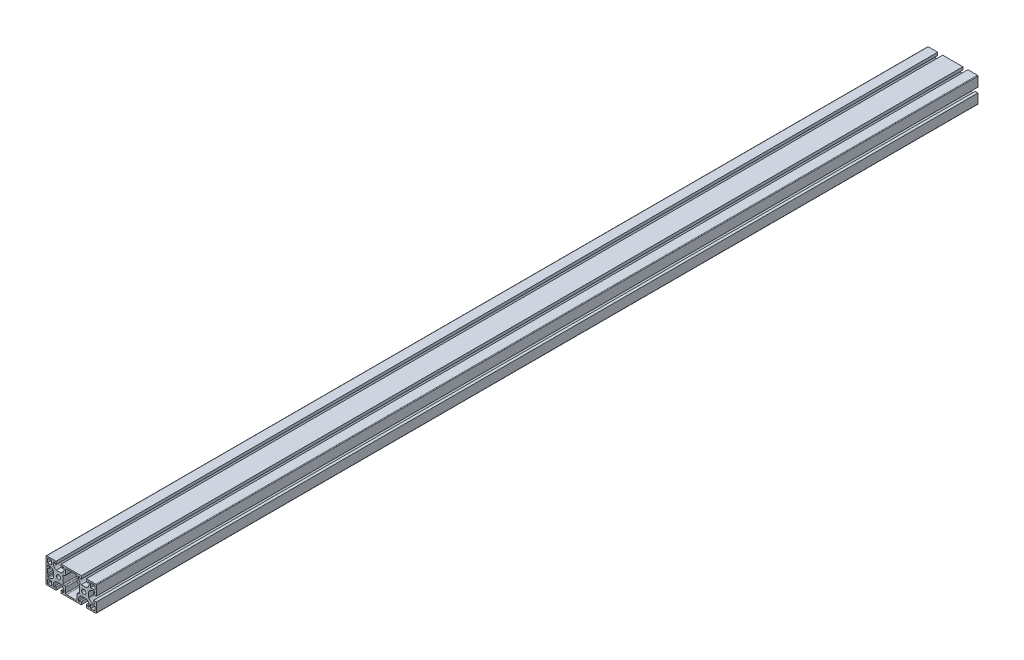
from build123d import *

# Parameters (mm, degrees)
SZKIC1_R                    = 3.4
DODANIE_WYCI_GNI_CIE1_DEPTH = 1400


with BuildPart() as part:
    # Szkic1 → Dodanie-wyciągnięcie1 (new body)
    with BuildSketch(Plane.XY):
        with BuildLine():
            Line((-40, -19), (-40, 19))
            ThreePointArc((-40, 19), (-39.707106781, 19.707106781), (-39, 20))
            Line((-39, 20), (-24, 20))
            Line((-24, 20), (-24, 15.5))
            Line((-24, 15.5), (-26.471381771, 15.5))
            Line((-26.471381771, 15.5), (-26.471381771, 17.75))
            ThreePointArc((-26.471381771, 17.75), (-28.062372029, 17.090990258), (-28.721381771, 15.5))
            ThreePointArc((-28.721381771, 15.5), (-27.448087912, 10.962546258), (-24, 7.75))
            Line((-24, 7.75), (-16, 7.75))
            ThreePointArc((-16, 7.75), (-12.551912088, 10.962546258), (-11.278618229, 15.5))
            ThreePointArc((-11.278618229, 15.5), (-11.937627971, 17.090990258), (-13.528618229, 17.75))
            Line((-13.528618229, 17.75), (-13.528618229, 15.5))
            Line((-13.528618229, 15.5), (-16, 15.5))
            Line((-16, 15.5), (-16, 20))
            Line((-16, 20), (13.528618229, 20))
            Line((13.528618229, 20), (16, 20))
            Line((16, 20), (16, 15.5))
            Line((16, 15.5), (13.528618229, 15.5))
            Line((13.528618229, 15.5), (13.528618229, 17.75))
            ThreePointArc((13.528618229, 17.75), (11.937627971, 17.090990258), (11.278618229, 15.5))
            ThreePointArc((11.278618229, 15.5), (12.551912088, 10.962546258), (16, 7.75))
            Line((16, 7.75), (24, 7.75))
            ThreePointArc((24, 7.75), (27.448087912, 10.962546258), (28.721381771, 15.5))
            ThreePointArc((28.721381771, 15.5), (28.062372029, 17.090990258), (26.471381771, 17.75))
            Line((26.471381771, 17.75), (26.471381771, 15.5))
            Line((26.471381771, 15.5), (24, 15.5))
            Line((24, 15.5), (24, 20))
            Line((24, 20), (39, 20))
            ThreePointArc((39, 20), (39.707106781, 19.707106781), (40, 19))
            Line((40, 19), (40, 4))
            Line((40, 4), (35.5, 4))
            Line((35.5, 4), (35.5, 6.471381771))
            Line((35.5, 6.471381771), (37.75, 6.471381771))
            ThreePointArc((37.75, 6.471381771), (37.090990258, 8.062372029), (35.5, 8.721381771))
            ThreePointArc((35.5, 8.721381771), (30.962546258, 7.448087912), (27.75, 4))
            Line((27.75, 4), (27.75, -4))
            ThreePointArc((27.75, -4), (30.962546258, -7.448087912), (35.5, -8.721381771))
            ThreePointArc((35.5, -8.721381771), (37.090990258, -8.062372029), (37.75, -6.471381771))
            Line((37.75, -6.471381771), (35.5, -6.471381771))
            Line((35.5, -6.471381771), (35.5, -4))
            Line((35.5, -4), (40, -4))
            Line((40, -4), (40, -19))
            ThreePointArc((40, -19), (39.707106781, -19.707106781), (39, -20))
            Line((39, -20), (24, -20))
            Line((24, -20), (24, -15.5))
            Line((24, -15.5), (26.471381771, -15.5))
            Line((26.471381771, -15.5), (26.471381771, -17.75))
            ThreePointArc((26.471381771, -17.75), (28.062372029, -17.090990258), (28.721381771, -15.5))
            ThreePointArc((28.721381771, -15.5), (27.448087912, -10.962546258), (24, -7.75))
            Line((24, -7.75), (16, -7.75))
            ThreePointArc((16, -7.75), (12.551912088, -10.962546258), (11.278618229, -15.5))
            ThreePointArc((11.278618229, -15.5), (11.937627971, -17.090990258), (13.528618229, -17.75))
            Line((13.528618229, -17.75), (13.528618229, -15.5))
            Line((13.528618229, -15.5), (16, -15.5))
            Line((16, -15.5), (16, -20))
            Line((16, -20), (-16, -20))
            Line((-16, -20), (-16, -15.5))
            Line((-16, -15.5), (-13.528618229, -15.5))
            Line((-13.528618229, -15.5), (-13.528618229, -17.75))
            ThreePointArc((-13.528618229, -17.75), (-11.937627971, -17.090990258), (-11.278618229, -15.5))
            ThreePointArc((-11.278618229, -15.5), (-12.551912088, -10.962546258), (-16, -7.75))
            Line((-16, -7.75), (-24, -7.75))
            ThreePointArc((-24, -7.75), (-27.448087912, -10.962546258), (-28.721381771, -15.5))
            ThreePointArc((-28.721381771, -15.5), (-28.062372029, -17.090990258), (-26.471381771, -17.75))
            Line((-26.471381771, -17.75), (-26.471381771, -15.5))
            Line((-26.471381771, -15.5), (-24, -15.5))
            Line((-24, -15.5), (-24, -20))
            Line((-24, -20), (-39, -20))
            ThreePointArc((-39, -20), (-39.707106781, -19.707106781), (-40, -19))
        make_face()
        with Locations((-20, 0)):
            Circle(SZKIC1_R, mode=Mode.SUBTRACT)
        with Locations((20, 0)):
            Circle(SZKIC1_R, mode=Mode.SUBTRACT)
        with BuildLine():
            Line((30.971381771, -17.75), (36.75, -17.75))
            ThreePointArc((36.75, -17.75), (37.457106781, -17.457106781), (37.75, -16.75))
            Line((37.75, -16.75), (37.75, -10.971381771))
            Line((37.75, -10.971381771), (30.971381771, -10.971381771))
            Line((30.971381771, -10.971381771), (30.971381771, -17.75))
        make_face(mode=Mode.SUBTRACT)
        with BuildLine():
            Line((-35.5, -6.471381771), (-37.75, -6.471381771))
            ThreePointArc((-37.75, -6.471381771), (-37.090990258, -8.062372029), (-35.5, -8.721381771))
            ThreePointArc((-35.5, -8.721381771), (-30.962546258, -7.448087912), (-27.75, -4))
            Line((-27.75, -4), (-27.75, 4))
            ThreePointArc((-27.75, 4), (-30.962546258, 7.448087912), (-35.5, 8.721381771))
            ThreePointArc((-35.5, 8.721381771), (-37.090990258, 8.062372029), (-37.75, 6.471381771))
            Line((-37.75, 6.471381771), (-35.5, 6.471381771))
            Line((-35.5, 6.471381771), (-35.5, 4))
            Line((-35.5, 4), (-37.75, 4))
            Line((-37.75, 4), (-37.75, -4))
            Line((-37.75, -4), (-35.5, -4))
            Line((-35.5, -4), (-35.5, -6.471381771))
        make_face(mode=Mode.SUBTRACT)
        with BuildLine():
            Line((10.528618229, 7.090188806), (11.40950808, 7.090188806))
            ThreePointArc((11.40950808, 7.090188806), (12.470168251, 6.650848977), (12.90950808, 5.590188806))
            Line((12.90950808, 5.590188806), (12.90950808, -5.590188806))
            ThreePointArc((12.90950808, -5.590188806), (12.470168251, -6.650848977), (11.40950808, -7.090188806))
            Line((11.40950808, -7.090188806), (10.528618229, -7.090188806))
            ThreePointArc((10.528618229, -7.090188806), (9.467958057, -7.529528634), (9.028618229, -8.590188806))
            Line((9.028618229, -8.590188806), (9.028618229, -16.25))
            ThreePointArc((9.028618229, -16.25), (8.589278401, -17.310660172), (7.528618229, -17.75))
            Line((7.528618229, -17.75), (-7.528618229, -17.75))
            ThreePointArc((-7.528618229, -17.75), (-8.589278401, -17.310660172), (-9.028618229, -16.25))
            Line((-9.028618229, -16.25), (-9.028618229, -8.590188806))
            ThreePointArc((-9.028618229, -8.590188806), (-9.467958057, -7.529528634), (-10.528618229, -7.090188806))
            Line((-10.528618229, -7.090188806), (-11.40950808, -7.090188806))
            ThreePointArc((-11.40950808, -7.090188806), (-12.470168251, -6.650848977), (-12.90950808, -5.590188806))
            Line((-12.90950808, -5.590188806), (-12.90950808, 5.590188806))
            ThreePointArc((-12.90950808, 5.590188806), (-12.470168251, 6.650848977), (-11.40950808, 7.090188806))
            Line((-11.40950808, 7.090188806), (-10.528618229, 7.090188806))
            ThreePointArc((-10.528618229, 7.090188806), (-9.467958057, 7.529528634), (-9.028618229, 8.590188806))
            Line((-9.028618229, 8.590188806), (-9.028618229, 16.25))
            ThreePointArc((-9.028618229, 16.25), (-8.589278401, 17.310660172), (-7.528618229, 17.75))
            Line((-7.528618229, 17.75), (7.528618229, 17.75))
            ThreePointArc((7.528618229, 17.75), (8.589278401, 17.310660172), (9.028618229, 16.25))
            Line((9.028618229, 16.25), (9.028618229, 8.590188806))
            ThreePointArc((9.028618229, 8.590188806), (9.467958057, 7.529528634), (10.528618229, 7.090188806))
        make_face(mode=Mode.SUBTRACT)
        with BuildLine():
            Line((30.971381771, 10.971381771), (37.75, 10.971381771))
            Line((37.75, 10.971381771), (37.75, 16.75))
            ThreePointArc((37.75, 16.75), (37.457106781, 17.457106781), (36.75, 17.75))
            Line((36.75, 17.75), (30.971381771, 17.75))
            Line((30.971381771, 17.75), (30.971381771, 10.971381771))
        make_face(mode=Mode.SUBTRACT)
        with BuildLine():
            Line((-30.971381771, -10.971381771), (-30.971381771, -17.75))
            Line((-30.971381771, -17.75), (-36.75, -17.75))
            ThreePointArc((-36.75, -17.75), (-37.457106781, -17.457106781), (-37.75, -16.75))
            Line((-37.75, -16.75), (-37.75, -10.971381771))
            Line((-37.75, -10.971381771), (-30.971381771, -10.971381771))
        make_face(mode=Mode.SUBTRACT)
        with BuildLine():
            Line((-30.971381771, 17.75), (-36.75, 17.75))
            ThreePointArc((-36.75, 17.75), (-37.457106781, 17.457106781), (-37.75, 16.75))
            Line((-37.75, 16.75), (-37.75, 10.971381771))
            Line((-37.75, 10.971381771), (-30.971381771, 10.971381771))
            Line((-30.971381771, 10.971381771), (-30.971381771, 17.75))
        make_face(mode=Mode.SUBTRACT)
    extrude(amount=DODANIE_WYCI_GNI_CIE1_DEPTH)


solid = part.part
